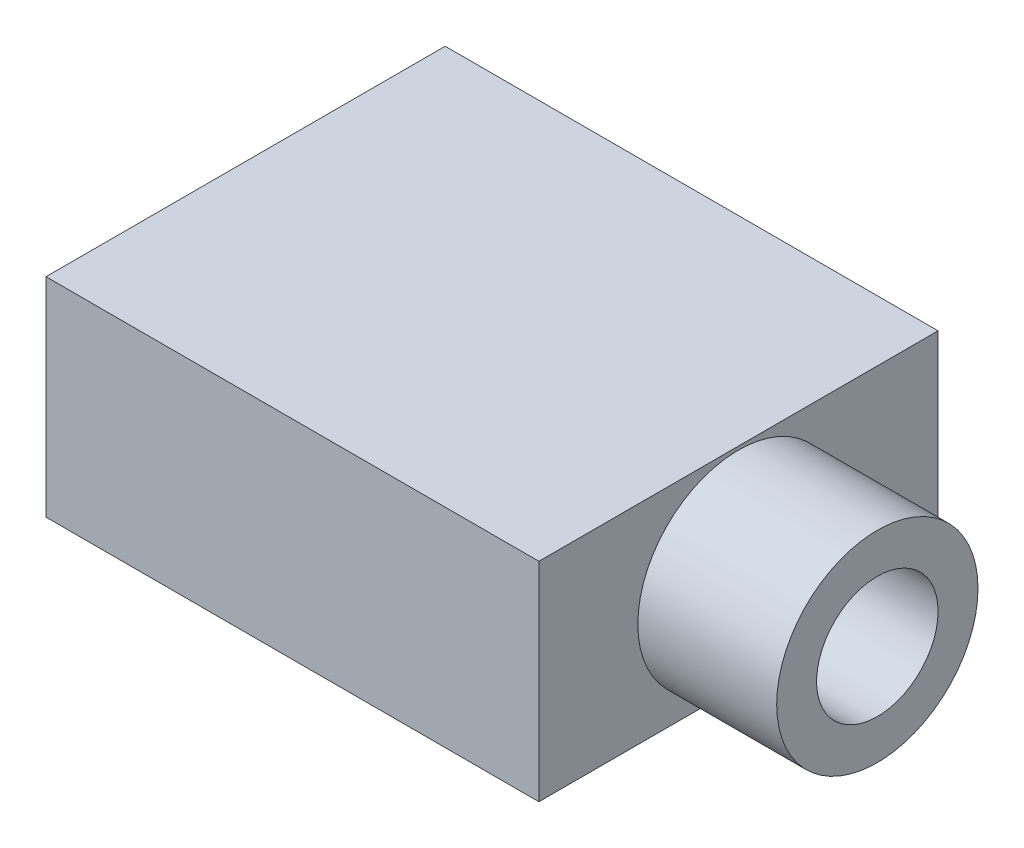
from build123d import *

# Parameters (mm, degrees)
SKETCH1_W           = 14.2
SKETCH1_H           = 11.5
BOSS_EXTRUDE1_DEPTH = 6
SKETCH2_R           = 2.9
BOSS_EXTRUDE2_DEPTH = 4
SKETCH3_R           = 1.75
CUT_EXTRUDE1_DEPTH  = 15


with BuildPart() as part:
    # Sketch1 → Boss-Extrude1 (new body)
    with BuildSketch(Plane(origin=(0, 0, 0), x_dir=(1, 0, 0), z_dir=(0, 1, 0))):
        with Locations((-58.404587156, 38.561926606)):
            Rectangle(SKETCH1_W, SKETCH1_H)
    extrude(amount=BOSS_EXTRUDE1_DEPTH)

    # Sketch2 → Boss-Extrude2 (add)
    with BuildSketch(Plane(origin=(-51.304587156, 0, 0), x_dir=(0, 0, -1), z_dir=(1, 0, 0))):
        with Locations(Location((38.561926606, 3, 0), (0, 0, 180))):
            Circle(SKETCH2_R)
    extrude(amount=BOSS_EXTRUDE2_DEPTH)

    # Sketch3 → Cut-Extrude1 (cut)
    with BuildSketch(Plane(origin=(-47.304587156, 0, 0), x_dir=(0, 0, -1), z_dir=(1, 0, 0))):
        with Locations((38.561926606, 3)):
            Circle(SKETCH3_R)
    extrude(amount=-CUT_EXTRUDE1_DEPTH, mode=Mode.SUBTRACT)


solid = part.part
